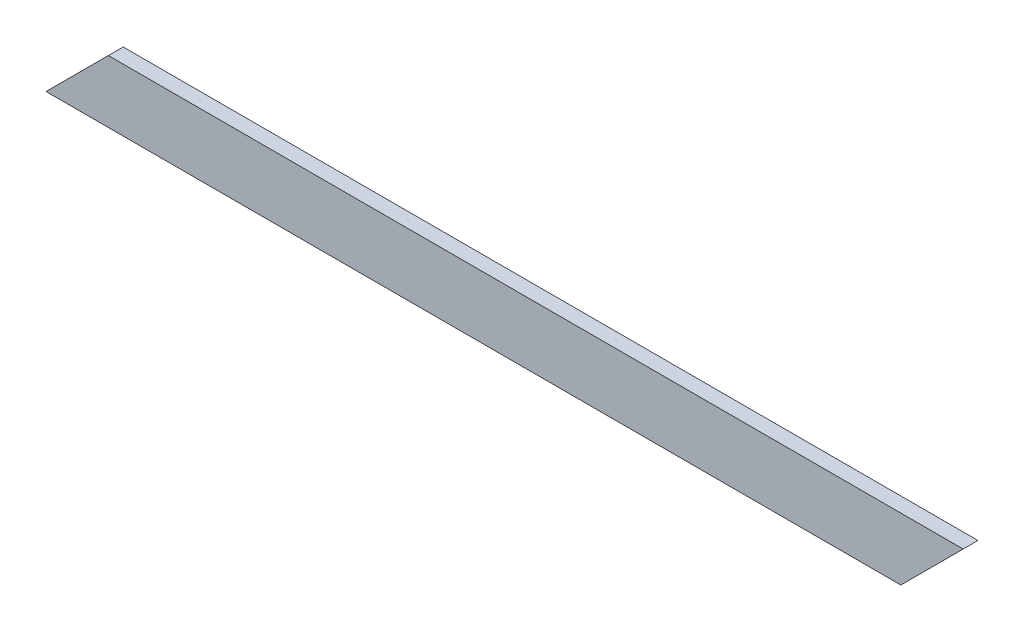
from build123d import *

# Parameters (mm, degrees)
BOSS_EXTRUDE3_DEPTH = 63.5


with BuildPart() as part:
    # Sketch4 → Boss-Extrude3 (new body)
    with BuildSketch(Plane.XY):
        Polygon((0, 0), (3657.6, 0), (3924.299999912, 266.699999912), (266.699999912, 266.699999912), align=None)
    extrude(amount=BOSS_EXTRUDE3_DEPTH)


solid = part.part
